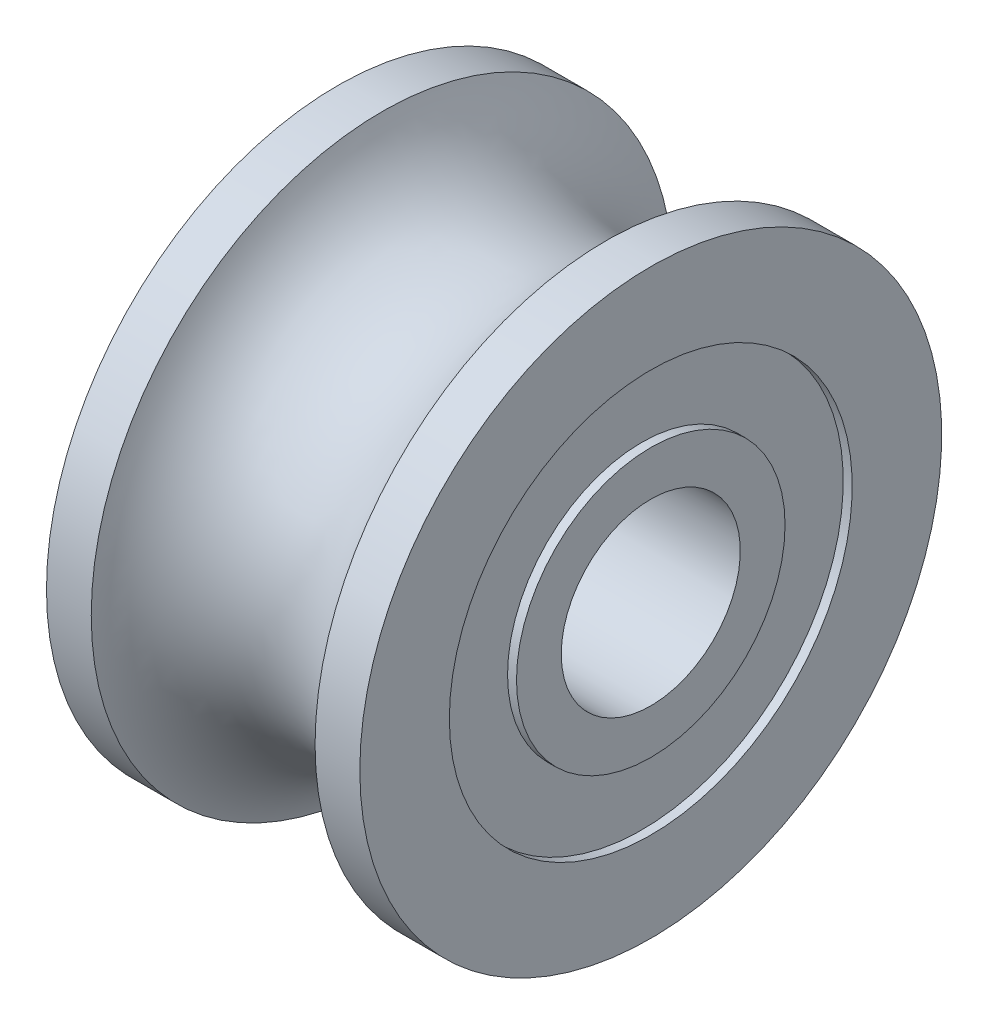
from build123d import *


with BuildPart() as part:
    # Esquisse1 → Révolution1 (revolve)
    with BuildSketch(Plane.XY, mode=Mode.PRIVATE) as r_volution1_sk:
        with BuildLine():
            Line((-3.5, 3), (-3.3, 3))
            Line((-3.3, 3), (-3.3, 4.5))
            Line((-3.3, 4.5), (-3.5, 4.5))
            Line((-3.5, 4.5), (-3.5, 6.5))
            Line((-3.5, 6.5), (-2.5, 6.5))
            ThreePointArc((-2.5, 6.5), (0, 4.75), (2.5, 6.5))
            Line((2.5, 6.5), (3.5, 6.5))
            Line((3.5, 6.5), (3.5, 4.5))
            Line((3.5, 4.5), (3.3, 4.5))
            Line((3.3, 4.5), (3.3, 3))
            Line((3.3, 3), (3.5, 3))
            Line((3.5, 3), (3.5, 2))
            Line((3.5, 2), (-3.5, 2))
            Line((-3.5, 2), (-3.5, 3))
        make_face()
    revolve(r_volution1_sk.sketch.rotate(Axis((-3.5, 0, 0), (1, 0, 0)), 90), axis=Axis((-3.5, 0, 0), (1, 0, 0)))


solid = part.part
